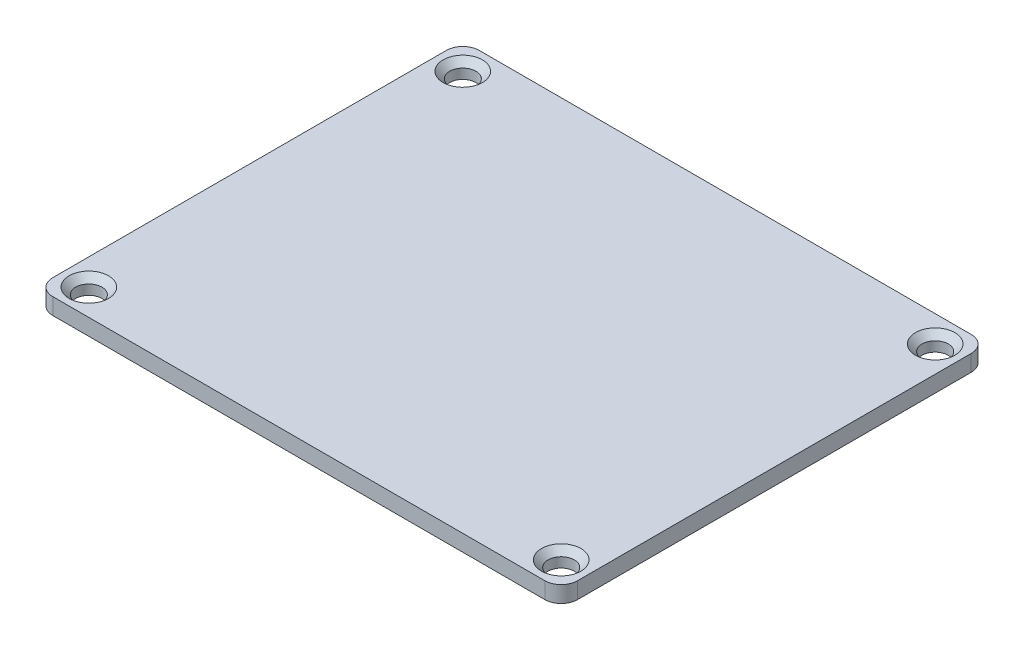
from build123d import *

# Parameters (mm, degrees)
CROQUIS1_W              = 80
CROQUIS1_H              = 65
SALIENTE_EXTRUIR1_DEPTH = 2.5
CORTAR_EXTRUIR1_REACH   = 53.599
CROQUIS2_R              = 2
REDONDEO1_R             = 2.5
CHAFL_N1_SIZE           = 1


with BuildPart() as part:
    # Croquis1 → Saliente-Extruir1 (new body)
    with BuildSketch(Plane(origin=(0, 0, 0), x_dir=(1, 0, 0), z_dir=(0, 1, 0))):
        Rectangle(CROQUIS1_W, CROQUIS1_H)
    extrude(amount=SALIENTE_EXTRUIR1_DEPTH)

    # Croquis2 → Cortar-Extruir1 (cut, up to next)
    with BuildSketch(Plane(origin=(0, 2.5, 0), x_dir=(1, 0, 0), z_dir=(0, 1, 0)), mode=Mode.PRIVATE) as cortar_extruir1_sk1:
        with Locations(Location((-36, 28.5, 0), (0, 0, 270))):
            Circle(CROQUIS2_R)
    cortar_extruir1_tool1 = extrude(cortar_extruir1_sk1.sketch, amount=-CORTAR_EXTRUIR1_REACH, mode=Mode.PRIVATE) & part.part
    # Croquis2 → Cortar-Extruir1 (cut, up to next)
    with BuildSketch(Plane(origin=(0, 2.5, 0), x_dir=(1, 0, 0), z_dir=(0, 1, 0)), mode=Mode.PRIVATE) as cortar_extruir1_sk2:
        with Locations(Location((36, 28.5, 0), (0, 0, 270))):
            Circle(CROQUIS2_R)
    cortar_extruir1_tool2 = extrude(cortar_extruir1_sk2.sketch, amount=-CORTAR_EXTRUIR1_REACH, mode=Mode.PRIVATE) & part.part
    # Croquis2 → Cortar-Extruir1 (cut, up to next)
    with BuildSketch(Plane(origin=(0, 2.5, 0), x_dir=(1, 0, 0), z_dir=(0, 1, 0)), mode=Mode.PRIVATE) as cortar_extruir1_sk3:
        with Locations(Location((-36, -28.5, 0), (0, 0, 270))):
            Circle(CROQUIS2_R)
    cortar_extruir1_tool3 = extrude(cortar_extruir1_sk3.sketch, amount=-CORTAR_EXTRUIR1_REACH, mode=Mode.PRIVATE) & part.part
    # Croquis2 → Cortar-Extruir1 (cut, up to next)
    with BuildSketch(Plane(origin=(0, 2.5, 0), x_dir=(1, 0, 0), z_dir=(0, 1, 0)), mode=Mode.PRIVATE) as cortar_extruir1_sk4:
        with Locations(Location((36, -28.5, 0), (0, 0, 270))):
            Circle(CROQUIS2_R)
    cortar_extruir1_tool4 = extrude(cortar_extruir1_sk4.sketch, amount=-CORTAR_EXTRUIR1_REACH, mode=Mode.PRIVATE) & part.part
    add(cortar_extruir1_tool1.solids().sort_by_distance((-36, 2.5, -28.5))[0], mode=Mode.SUBTRACT)
    add(cortar_extruir1_tool2.solids().sort_by_distance((36, 2.5, -28.5))[0], mode=Mode.SUBTRACT)
    add(cortar_extruir1_tool3.solids().sort_by_distance((-36, 2.5, 28.5))[0], mode=Mode.SUBTRACT)
    add(cortar_extruir1_tool4.solids().sort_by_distance((36, 2.5, 28.5))[0], mode=Mode.SUBTRACT)

    # Redondeo1
    redondeo1_edges = [part.edges().sort_by_distance(p)[0] for p in [
        (-40, 1.25, -32.5),
        (40, 1.25, -32.5),
        (40, 1.25, 32.5),
        (-40, 1.25, 32.5),
    ]]
    fillet(redondeo1_edges, radius=REDONDEO1_R)

    # Chaflán1
    chafl_n1_edges = [part.edges().sort_by_distance(p)[0] for p in [
        (36, 2.5, -30.5),
        (-36, 2.5, 26.5),
        (36, 2.5, 26.5),
        (-36, 2.5, -30.5),
    ]]
    chamfer(chafl_n1_edges, length=CHAFL_N1_SIZE)


solid = part.part
